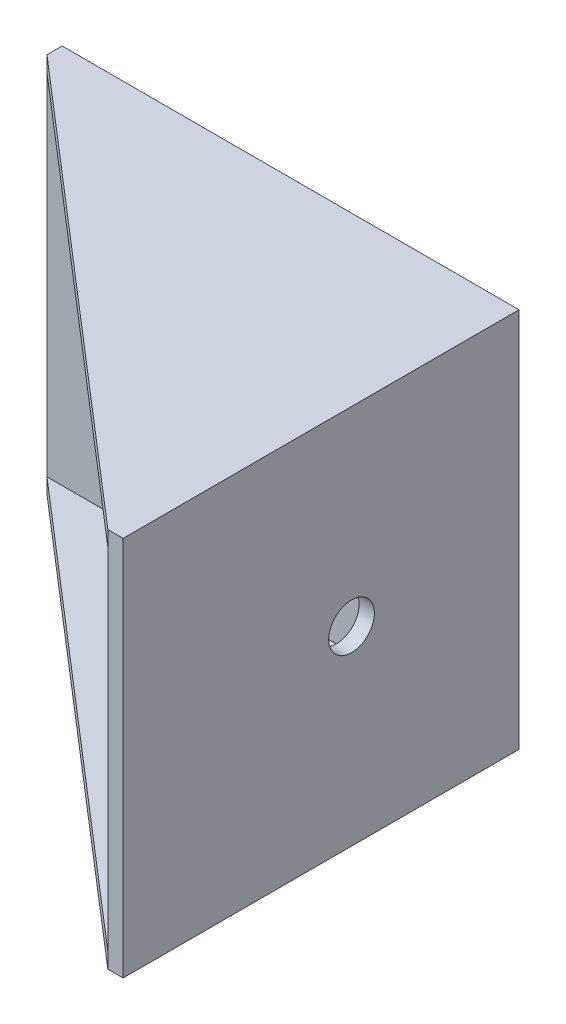
from build123d import *

# Parameters (mm, degrees)
SKETCH1_W           = 30
SKETCH1_H           = 25
BOSS_EXTRUDE1_DEPTH = 1
SKETCH2_W           = 1
SKETCH2_H           = 25
BOSS_EXTRUDE2_DEPTH = 25
BOSS_EXTRUDE3_DEPTH = 1
SKETCH7_R           = 1.5
CUT_EXTRUDE1_DEPTH  = 3


with BuildPart() as part:
    # Sketch1 → Boss-Extrude1 (new body)
    with BuildSketch(Plane.XY):
        Rectangle(SKETCH1_W, SKETCH1_H)
    extrude(amount=BOSS_EXTRUDE1_DEPTH)

    # Sketch2 → Boss-Extrude2 (add)
    with BuildSketch(Plane.XY.offset(1)):
        with Locations((14.5, 0)):
            Rectangle(SKETCH2_W, SKETCH2_H)
    extrude(amount=BOSS_EXTRUDE2_DEPTH)

    # Sketch6 → Boss-Extrude3 (add)
    with BuildSketch(Plane.XZ.offset(12.5)):
        Polygon((14, 26), (-15, 1), (14, 1), align=None)
    boss_extrude3 = extrude(amount=-BOSS_EXTRUDE3_DEPTH)

    # Mirror2: Boss-Extrude3 across plane
    add(boss_extrude3.mirror(Plane.ZX))

    # Sketch7 → Cut-Extrude1 (cut)
    with BuildSketch(Plane.ZY.offset(-14)):
        with Locations(Location((11, 0, 0), (0, 0, 270))):
            Circle(SKETCH7_R)
    extrude(amount=-CUT_EXTRUDE1_DEPTH, mode=Mode.SUBTRACT)


solid = part.part
